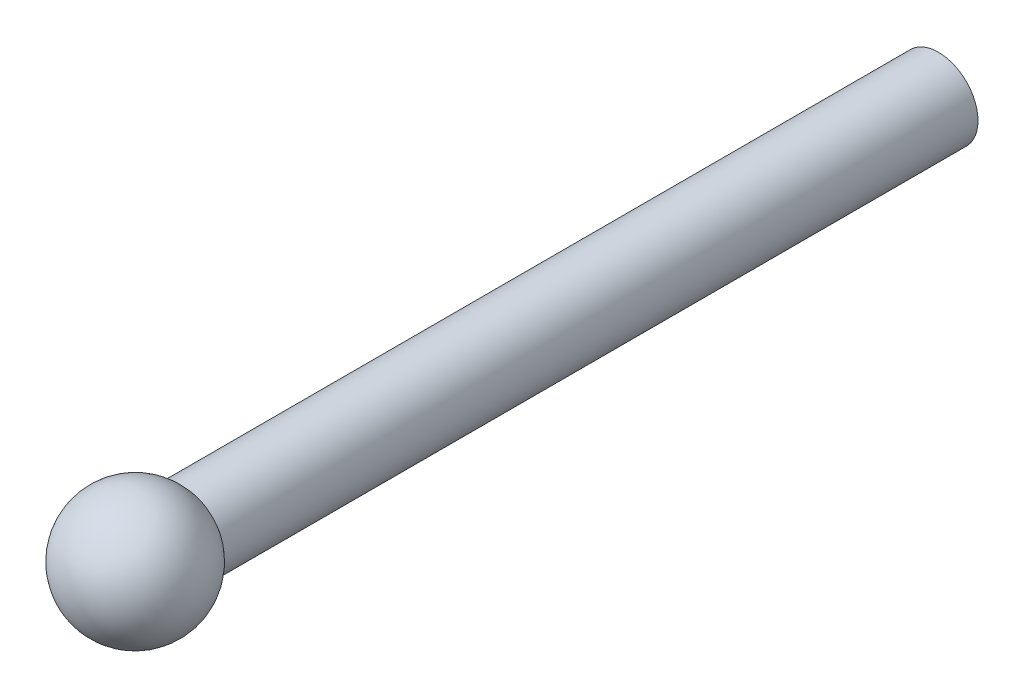
from build123d import *

# Parameters (mm, degrees)
SKETCH4_R           = 1.5
BOSS_EXTRUDE4_DEPTH = 30


with BuildPart() as part:
    # Sketch4 → Boss-Extrude4 (new body)
    with BuildSketch(Plane.XY):
        Circle(SKETCH4_R)
    extrude(amount=-BOSS_EXTRUDE4_DEPTH)

    # Sketch6 → Revolve1 (revolve)
    with BuildSketch(Plane.XY.offset(0.5)):
        with BuildLine():
            Line((0, 2.4), (0, 0))
            Line((0, 0), (0, -2.4))
            ThreePointArc((0, -2.4), (2.4, 0), (0, 2.4))
        make_face()
    revolve(axis=Axis((0, -2.4, 0.5), (0, 1, 0)))


solid = part.part
